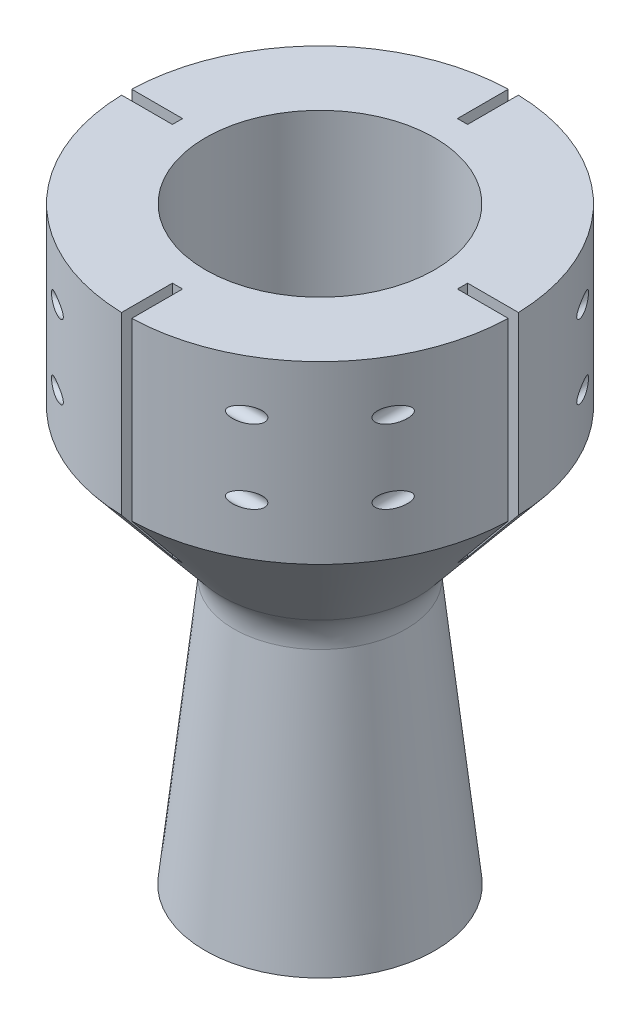
from build123d import *

# Parameters (mm, degrees)
SKETCH1_R               = 38
SKETCH1_R_2             = 22.5
BOSS_EXTRUDE1_DEPTH     = 34.5
SKETCH4_W               = 2
SKETCH4_H               = 20
SKETCH4_W_2             = 20
SKETCH4_H_2             = 2
CUT_EXTRUDE1_DEPTH      = 128.674178076
CUT_EXTRUDE2_DEPTH      = 98.456838694
CUT_EXTRUDE2_DEPTH_BACK = 98.456838694
SKETCH5_R               = 1.5
CUT_EXTRUDE3_DEPTH      = 98.456838772
CUT_EXTRUDE3_DEPTH_BACK = 98.456838772
SKETCH6_R               = 1.5


with BuildPart() as part:
    # Sketch1 → Boss-Extrude1 (new body)
    with BuildSketch(Plane(origin=(0, 0, 0), x_dir=(1, 0, 0), z_dir=(0, 1, 0))):
        with Locations(Location((0, 0, 0), (0, 0, 270))):
            Circle(SKETCH1_R)
        with Locations(Location((0, 0, 0), (0, 0, 270))):
            Circle(SKETCH1_R_2, mode=Mode.SUBTRACT)
    extrude(amount=BOSS_EXTRUDE1_DEPTH)

    # Sketch3 → Revolve1 (revolve)
    with BuildSketch(Plane.XY, mode=Mode.PRIVATE) as revolve1_sk:
        with BuildLine():
            Line((-38, 0), (-19.230176899, -22.753180828))
            ThreePointArc((-19.230176899, -22.753180828), (-17.490178321, -25.857543813), (-16.947495803, -29.374667677))
            Line((-16.947495803, -29.374667677), (-22.554087025, -81.313193322))
            Line((-22.554087025, -81.313193322), (-18.554087025, -81.313193322))
            Line((-18.554087025, -81.313193322), (-13.859080339, -31.534112252))
            ThreePointArc((-13.859080339, -31.534112252), (-13.993231878, -24.725737125), (-15.659373991, -18.123015037))
            Line((-15.659373991, -18.123015037), (-22.5, 0))
            Line((-22.5, 0), (-38, 0))
        make_face()
    revolve(revolve1_sk.sketch.rotate(Axis((0, 0, 0), (0, 1, 0)), 270), axis=Axis((0, 0, 0), (0, 1, 0)))

    # Sketch4 → Cut-Extrude1 (cut, through all)
    with BuildSketch(Plane(origin=(0, 34.5, 0), x_dir=(1, 0, 0), z_dir=(0, 1, 0))):
        with Locations((0, 38)):
            Rectangle(SKETCH4_W, SKETCH4_H)
        with Locations((38, 0)):
            Rectangle(SKETCH4_W_2, SKETCH4_H_2)
        with Locations((0, -38)):
            Rectangle(SKETCH4_W, SKETCH4_H)
        with Locations((-38, 0)):
            Rectangle(SKETCH4_W_2, SKETCH4_H_2)
    extrude(amount=-CUT_EXTRUDE1_DEPTH, mode=Mode.SUBTRACT)

    # Sketch5 → Cut-Extrude2 (cut, two sides: drawn at the far end of the back side and taken through both)
    with BuildSketch(Plane(origin=(0, 0, 0), x_dir=(0, 0, -1), z_dir=(1, 0, 0)).offset(-CUT_EXTRUDE2_DEPTH_BACK)):
        with Locations((33, 24.5)):
            Circle(SKETCH5_R)
        with Locations((33, 10)):
            Circle(SKETCH5_R)
        with Locations((-33, 10)):
            Circle(SKETCH5_R)
        with Locations((-33, 24.5)):
            Circle(SKETCH5_R)
    extrude(amount=CUT_EXTRUDE2_DEPTH + CUT_EXTRUDE2_DEPTH_BACK, mode=Mode.SUBTRACT)

    # Sketch6 → Cut-Extrude3 (cut, two sides: drawn at the far end of the back side and taken through both)
    with BuildSketch(Plane.XY.offset(-CUT_EXTRUDE3_DEPTH_BACK)):
        with Locations((-32.986839826, 24.5)):
            Circle(SKETCH6_R)
        with Locations((-32.986839826, 10)):
            Circle(SKETCH6_R)
        with Locations((32.986839826, 10)):
            Circle(SKETCH6_R)
        with Locations((32.986839826, 24.5)):
            Circle(SKETCH6_R)
    extrude(amount=CUT_EXTRUDE3_DEPTH + CUT_EXTRUDE3_DEPTH_BACK, mode=Mode.SUBTRACT)


solid = part.part
